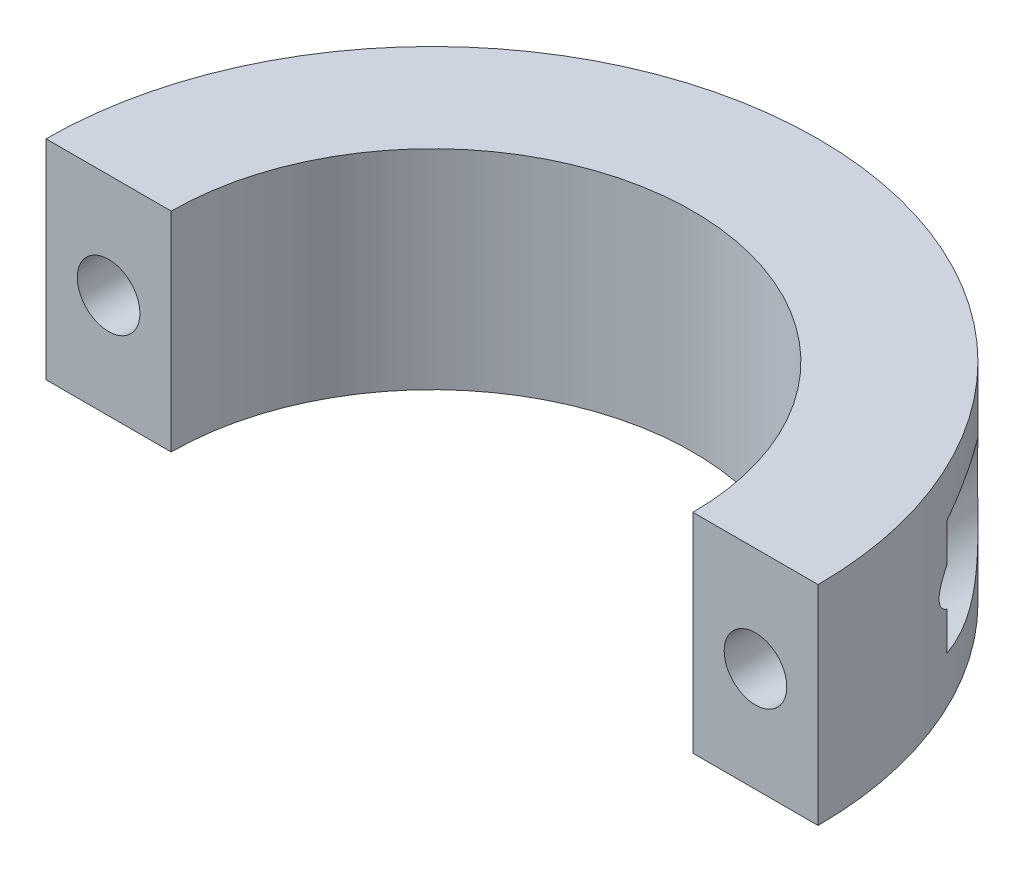
from build123d import *

# Parameters (mm, degrees)
BOSS_EXTRUDE1_DEPTH = 10
SKETCH2_R           = 1.5
CUT_EXTRUDE1_DEPTH  = 8
SKETCH3_R           = 3
CUT_EXTRUDE2_DEPTH  = 24.505318713


with BuildPart() as part:
    # Sketch1 → Boss-Extrude1 (new body)
    with BuildSketch(Plane(origin=(0, 0, 0), x_dir=(1, 0, 0), z_dir=(0, 1, 0))):
        with BuildLine():
            ThreePointArc((-12.5, 0), (0, 12.5), (12.5, 0))
            Line((12.5, 0), (18.5, 0))
            ThreePointArc((18.5, 0), (0, 18.5), (-18.5, 0))
            Line((-18.5, 0), (-12.5, 0))
        make_face()
    extrude(amount=BOSS_EXTRUDE1_DEPTH)

    # Sketch2 → Cut-Extrude1 (cut)
    with BuildSketch(Plane.XY):
        with Locations((-15.5, 5)):
            Circle(SKETCH2_R)
    cut_extrude1 = extrude(amount=-CUT_EXTRUDE1_DEPTH, mode=Mode.SUBTRACT)

    # Sketch3 → Cut-Extrude2 (cut, through all)
    with BuildSketch(Plane.XY.offset(-8)):
        with Locations((-15.5, 5)):
            Circle(SKETCH3_R)
    cut_extrude2 = extrude(amount=-CUT_EXTRUDE2_DEPTH, mode=Mode.SUBTRACT)

    # Mirror1: Cut-Extrude1, Cut-Extrude2 across plane
    add(cut_extrude1.mirror(Plane(origin=(0, 0, 0), x_dir=(0, 0, 1), z_dir=(1, 0, 0))), mode=Mode.SUBTRACT)
    add(cut_extrude2.mirror(Plane(origin=(0, 0, 0), x_dir=(0, 0, 1), z_dir=(1, 0, 0))), mode=Mode.SUBTRACT)


solid = part.part
